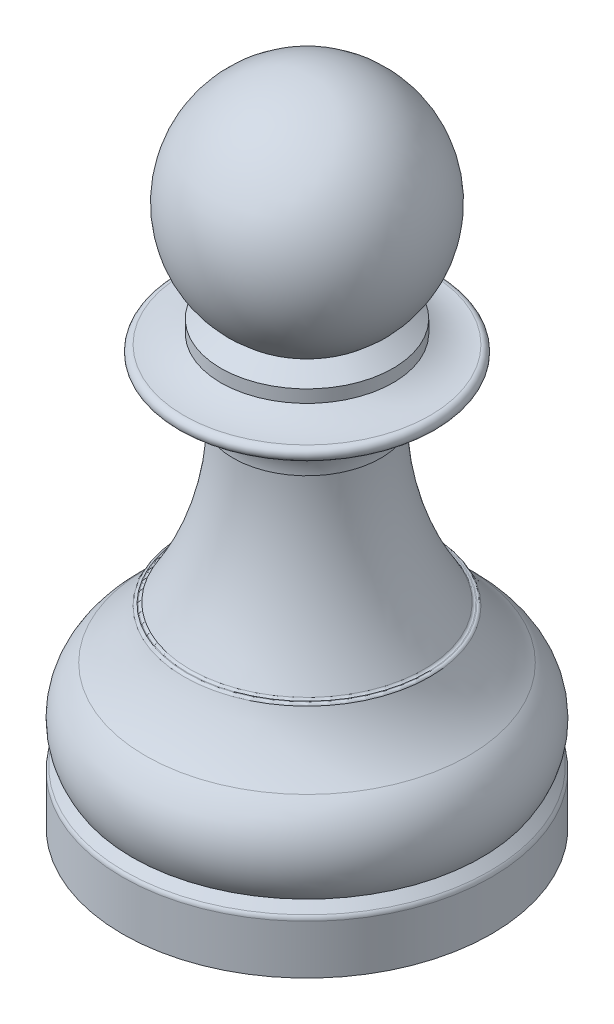
from build123d import *

# Parameters (mm, degrees)
SCALE2_SCALE       = 0.766666667
SKETCH2_R          = 10.2
CUT_EXTRUDE1_DEPTH = 7
SKETCH9_W          = 10.75
SKETCH9_H          = 1


with BuildPart() as part:
    # Sketch1 → Revolve1 (revolve)
    with BuildSketch(Plane.XY, mode=Mode.PRIVATE) as revolve1_sk:
        with BuildLine():
            Line((-15.0008, 4), (-15.0008, 0))
            Line((-15.0008, 0), (0, 0))
            Line((0, 0), (0, 53))
            ThreePointArc((0, 53), (-8.518072869, 46.905586789), (-5.5, 36.876096576))
            Line((-5.5, 36.876096576), (-7, 35.825785268))
            Line((-7, 35.825785268), (-7, 34.803847577))
            ThreePointArc((-7, 34.803847577), (-8.447085729, 34.204445042), (-10, 34))
            ThreePointArc((-10, 34), (-10.5, 33.5), (-10, 33))
            ThreePointArc((-10, 33), (-8.197089197, 32.570645969), (-6.781221904, 31.374756318))
            ThreePointArc((-6.781221904, 31.374756318), (-6.200321567, 30.249977523), (-6, 29))
            Line((-6, 29), (-5.75, 29))
            ThreePointArc((-5.75, 29), (-5.918561958, 26.110624511), (-6.421960889, 23.260450242))
            ThreePointArc((-6.421960889, 23.260450242), (-7.661665867, 19.442372993), (-9.5, 15.873744415))
            ThreePointArc((-9.5, 15.873744415), (-9.59085457, 15.787272908), (-9.712270825, 15.75580916))
            Line((-9.712270825, 15.75580916), (-9.772727273, 15.75580916))
            ThreePointArc((-9.772727273, 15.75580916), (-9.907750675, 15.716210398), (-10, 15.609958607))
            ThreePointArc((-10, 15.609958607), (-11.32842315, 13.42468716), (-13.12555, 11.605221731))
            ThreePointArc((-13.12555, 11.605221731), (-14.934993933, 8.510433694), (-14.207906855, 5))
            Line((-14.207906855, 5), (-14.854353411, 4.35355337))
            ThreePointArc((-14.854353411, 4.35355337), (-14.962739772, 4.191341703), (-15.0008, 4))
        make_face()
    revolve(revolve1_sk.sketch.rotate(Axis((0, 0, 0), (0, -1, 0)), 270), axis=Axis((0, 0, 0), (0, -1, 0)))


with BuildPart() as part_1:
    # Scale2: scaled about (0, 0, 0)
    add(part.part.scale(SCALE2_SCALE))

    # Sketch2 → Cut-Extrude1 (cut)
    with BuildSketch(Plane.XZ):
        with Locations(Location((0, 0, 0), (0, 0, 270))):
            Circle(SKETCH2_R)
    extrude(amount=-CUT_EXTRUDE1_DEPTH, mode=Mode.SUBTRACT)

    # Sketch9 → Cut-Revolve1 (revolve, cut)
    with BuildSketch(Plane.XY, mode=Mode.PRIVATE) as cut_revolve1_sk:
        with Locations((-5.375, 0.5)):
            Rectangle(SKETCH9_W, SKETCH9_H)
    revolve(cut_revolve1_sk.sketch.rotate(Axis((0, 0, 0), (0, -1, 0)), 270), axis=Axis((0, 0, 0), (0, -1, 0)), mode=Mode.SUBTRACT)


with BuildPart() as body_2:
    # Sketch10 → Base (White Pawn) (revolve)
    with BuildSketch(Plane.XY, mode=Mode.PRIVATE) as base_white_pawn_sk:
        Polygon((-10.55, 0), (0, 0), (0, 0.5), (-10.2, 0.5), (-10.2, 1), (-10.55, 1), align=None)
    revolve(base_white_pawn_sk.sketch.rotate(Axis((0, 0, 0), (0, -1, 0)), 270), axis=Axis((0, 0, 0), (0, -1, 0)))


solid = Compound([part_1.part, body_2.part])
